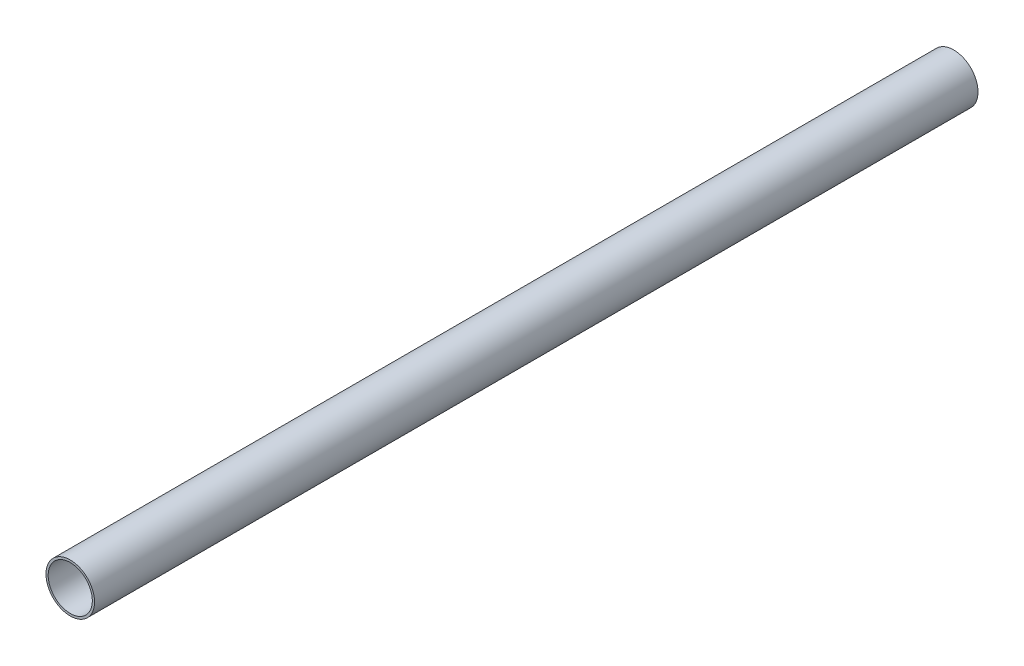
from build123d import *

# Parameters (mm, degrees)
SKETCH_1_R          = 55
EXTRUDE_1_DEPTH     = 2000
SKETCH_2_R          = 50
CUT_EXTRUDE_1_DEPTH = 1900
SCALE_1_SCALE       = 0.345


with BuildPart() as part:
    # 草图1 → 凸台-拉伸1 (new body)
    with BuildSketch(Plane.XY):
        Circle(SKETCH_1_R)
    extrude(amount=EXTRUDE_1_DEPTH)

    # 草图2 → 切除-拉伸1 (cut)
    with BuildSketch(Plane.XY.offset(2000)):
        Circle(SKETCH_2_R)
    extrude(amount=-CUT_EXTRUDE_1_DEPTH, mode=Mode.SUBTRACT)


with BuildPart() as part_1:
    # 缩放比例1: scaled about (0, 0, 0)
    add(part.part.scale(SCALE_1_SCALE))


solid = part_1.part
